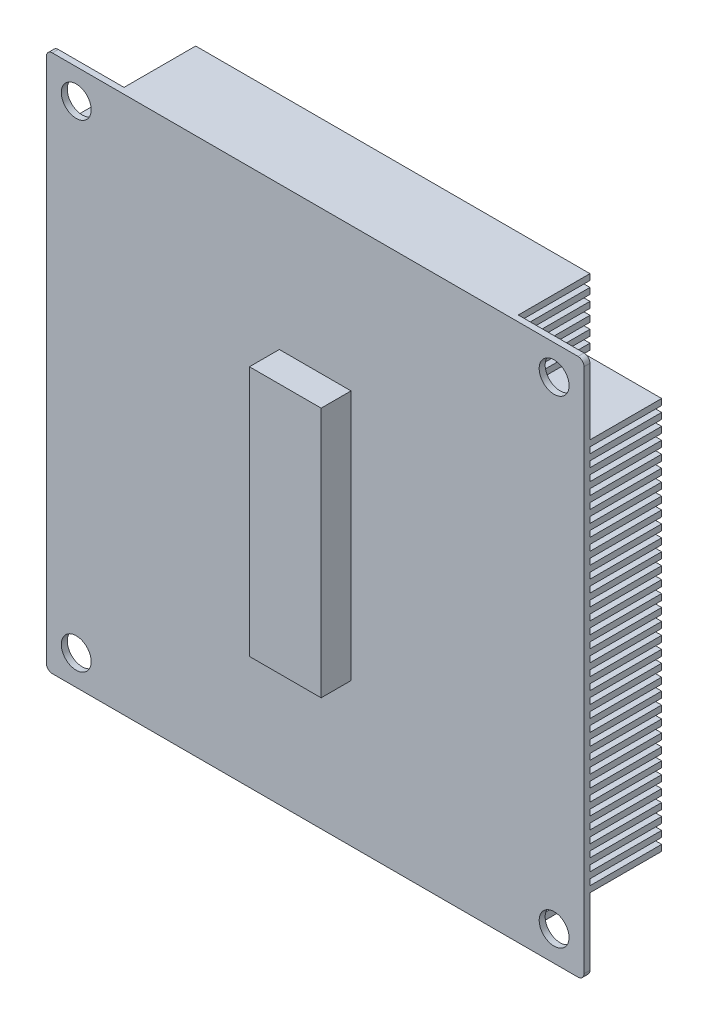
from build123d import *

# Parameters (mm, degrees)
SKETCH_1_W          = 90
SKETCH_1_H          = 90
EXTRUDE_1_DEPTH     = 13
SKETCH_2_W          = 12
SKETCH_2_H          = 42
EXTRUDE_2_DEPTH     = 5
SKETCH_5_W          = 12
SKETCH_5_H          = 1
CUT_EXTRUDE_5_DEPTH = 90
SKETCH_6_W          = 12
SKETCH_6_H          = 12
CUT_EXTRUDE_6_DEPTH = 12
SKETCH_7_R          = 2.5
CUT_EXTRUDE_7_DEPTH = 110.032474174
FILLET_1_R          = 1


with BuildPart() as part:
    # 草图1 → 凸台-拉伸1 (new body)
    with BuildSketch(Plane.XY):
        with Locations((-50.991707197, -5.295850463)):
            Rectangle(SKETCH_1_W, SKETCH_1_H)
    extrude(amount=EXTRUDE_1_DEPTH)

    # 草图2 → 凸台-拉伸2 (add)
    with BuildSketch(Plane.XY.offset(13)):
        with Locations((-50.991707197, -5.295850463)):
            Rectangle(SKETCH_2_W, SKETCH_2_H)
    extrude(amount=EXTRUDE_2_DEPTH)

    # 草图5 → 切除-拉伸5 (cut)
    with BuildSketch(Plane.ZY.offset(95.991707197)):
        with Locations((6, 38.204149537)):
            Rectangle(SKETCH_5_W, SKETCH_5_H)
        with Locations((6, 36.184149537)):
            Rectangle(SKETCH_5_W, SKETCH_5_H)
        with Locations((6, 34.164149537)):
            Rectangle(SKETCH_5_W, SKETCH_5_H)
        with Locations((6, 32.144149537)):
            Rectangle(SKETCH_5_W, SKETCH_5_H)
        with Locations((6, 30.124149537)):
            Rectangle(SKETCH_5_W, SKETCH_5_H)
        with Locations((6, 28.104149537)):
            Rectangle(SKETCH_5_W, SKETCH_5_H)
        with Locations((6, 26.084149537)):
            Rectangle(SKETCH_5_W, SKETCH_5_H)
        with Locations((6, 24.064149537)):
            Rectangle(SKETCH_5_W, SKETCH_5_H)
        with Locations((6, 22.044149537)):
            Rectangle(SKETCH_5_W, SKETCH_5_H)
        with Locations((6, 20.024149537)):
            Rectangle(SKETCH_5_W, SKETCH_5_H)
        with Locations((6, 18.004149537)):
            Rectangle(SKETCH_5_W, SKETCH_5_H)
        with Locations((6, 15.984149537)):
            Rectangle(SKETCH_5_W, SKETCH_5_H)
        with Locations((6, 13.964149537)):
            Rectangle(SKETCH_5_W, SKETCH_5_H)
        with Locations((6, 11.944149537)):
            Rectangle(SKETCH_5_W, SKETCH_5_H)
        with Locations((6, 9.924149537)):
            Rectangle(SKETCH_5_W, SKETCH_5_H)
        with Locations((6, 7.904149537)):
            Rectangle(SKETCH_5_W, SKETCH_5_H)
        with Locations((6, 5.884149537)):
            Rectangle(SKETCH_5_W, SKETCH_5_H)
        with Locations((6, 3.864149537)):
            Rectangle(SKETCH_5_W, SKETCH_5_H)
        with Locations((6, 1.844149537)):
            Rectangle(SKETCH_5_W, SKETCH_5_H)
        with Locations((6, -0.175850463)):
            Rectangle(SKETCH_5_W, SKETCH_5_H)
        with Locations((6, -2.195850463)):
            Rectangle(SKETCH_5_W, SKETCH_5_H)
        with Locations((6, -4.215850463)):
            Rectangle(SKETCH_5_W, SKETCH_5_H)
        with Locations((6, -6.235850463)):
            Rectangle(SKETCH_5_W, SKETCH_5_H)
        with Locations((6, -8.255850463)):
            Rectangle(SKETCH_5_W, SKETCH_5_H)
        with Locations((6, -10.275850463)):
            Rectangle(SKETCH_5_W, SKETCH_5_H)
        with Locations((6, -12.295850463)):
            Rectangle(SKETCH_5_W, SKETCH_5_H)
        with Locations((6, -14.315850463)):
            Rectangle(SKETCH_5_W, SKETCH_5_H)
        with Locations((6, -16.335850463)):
            Rectangle(SKETCH_5_W, SKETCH_5_H)
        with Locations((6, -18.355850463)):
            Rectangle(SKETCH_5_W, SKETCH_5_H)
        with Locations((6, -20.375850463)):
            Rectangle(SKETCH_5_W, SKETCH_5_H)
        with Locations((6, -22.395850463)):
            Rectangle(SKETCH_5_W, SKETCH_5_H)
        with Locations((6, -24.415850463)):
            Rectangle(SKETCH_5_W, SKETCH_5_H)
        with Locations((6, -26.435850463)):
            Rectangle(SKETCH_5_W, SKETCH_5_H)
        with Locations((6, -28.455850463)):
            Rectangle(SKETCH_5_W, SKETCH_5_H)
        with Locations((6, -30.475850463)):
            Rectangle(SKETCH_5_W, SKETCH_5_H)
        with Locations((6, -32.495850463)):
            Rectangle(SKETCH_5_W, SKETCH_5_H)
        with Locations((6, -34.515850463)):
            Rectangle(SKETCH_5_W, SKETCH_5_H)
        with Locations((6, -36.535850463)):
            Rectangle(SKETCH_5_W, SKETCH_5_H)
        with Locations((6, -38.555850463)):
            Rectangle(SKETCH_5_W, SKETCH_5_H)
        with Locations((6, -40.575850463)):
            Rectangle(SKETCH_5_W, SKETCH_5_H)
        with Locations((6, -42.595850463)):
            Rectangle(SKETCH_5_W, SKETCH_5_H)
        with Locations((6, -44.615850463)):
            Rectangle(SKETCH_5_W, SKETCH_5_H)
        with Locations((6, -46.635850463)):
            Rectangle(SKETCH_5_W, SKETCH_5_H)
        with Locations((6, -48.655850463)):
            Rectangle(SKETCH_5_W, SKETCH_5_H)
    extrude(amount=-CUT_EXTRUDE_5_DEPTH, mode=Mode.SUBTRACT)

    # 草图6 → 切除-拉伸6 (cut)
    with BuildSketch(Plane(origin=(0, 0, 0), x_dir=(-1, 0, 0), z_dir=(0, 0, -1))):
        with Locations((11.991707197, -44.295850463)):
            Rectangle(SKETCH_6_W, SKETCH_6_H)
        with Locations((89.991707197, -44.295850463)):
            Rectangle(SKETCH_6_W, SKETCH_6_H)
        with Locations((89.991707197, 33.704149537)):
            Rectangle(SKETCH_6_W, SKETCH_6_H)
        with Locations((11.991707197, 33.704149537)):
            Rectangle(SKETCH_6_W, SKETCH_6_H)
    extrude(amount=-CUT_EXTRUDE_6_DEPTH, mode=Mode.SUBTRACT)

    # 草图7 → 切除-拉伸7 (cut, through all)
    with BuildSketch(Plane(origin=(0, 0, 12), x_dir=(-1, 0, 0), z_dir=(0, 0, -1))):
        with Locations((10.991707197, 34.704149537)):
            Circle(SKETCH_7_R)
        with Locations((10.991707197, -45.295850463)):
            Circle(SKETCH_7_R)
        with Locations((90.991707197, 34.704149537)):
            Circle(SKETCH_7_R)
        with Locations((90.991707197, -45.295850463)):
            Circle(SKETCH_7_R)
    extrude(amount=-CUT_EXTRUDE_7_DEPTH, mode=Mode.SUBTRACT)

    # 圆角1
    fillet_1_edges = [part.edges().sort_by_distance(p)[0] for p in [
        (-95.991707197, 39.704149537, 12.5),
        (-5.991707197, 39.704149537, 12.5),
        (-5.991707197, -50.295850463, 12.5),
        (-95.991707197, -50.295850463, 12.5),
    ]]
    fillet(fillet_1_edges, radius=FILLET_1_R)


solid = part.part
